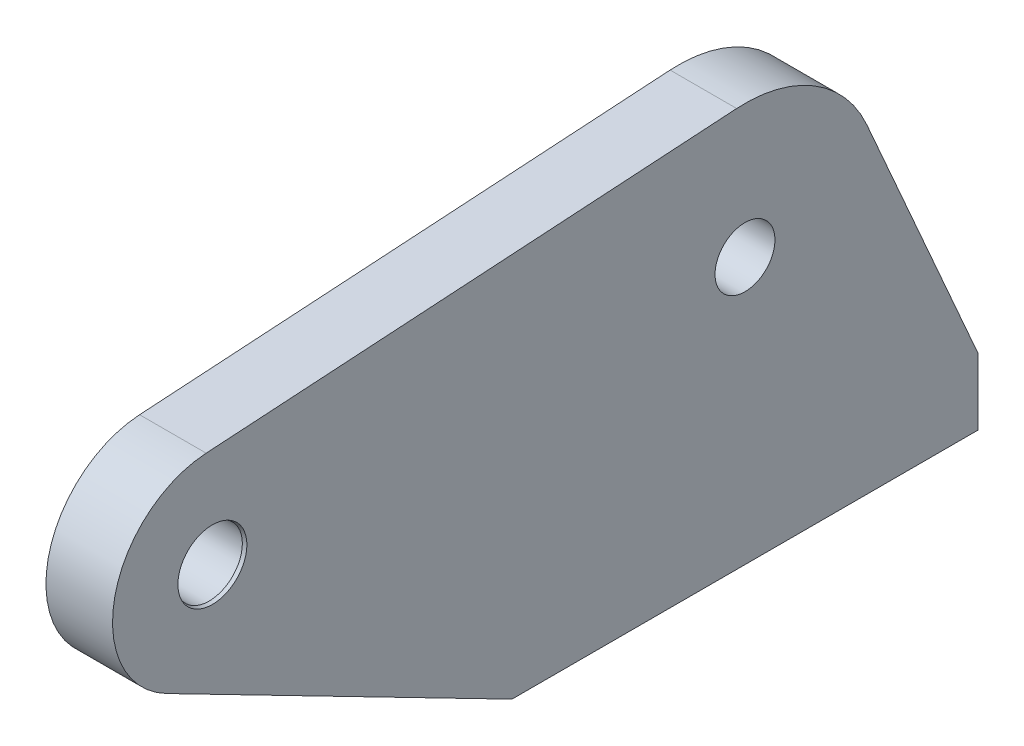
from build123d import *

# Parameters (mm, degrees)
BOSS_EXTRUDE1_DEPTH      = 5
F_9_0_9_DIAMETER_HOLE1_D = 9
M4_TAPPED_HOLE1_D        = 3.3
M4_TAPPED_HOLE1_DEPTH    = 11.5
M4_TAPPED_HOLE1_TIP      = 0.991420021
BOSS_EXTRUDE2_DEPTH      = 10
SKETCH8_R                = 5
CUT_EXTRUDE1_DEPTH       = 10
CHAMFER1_SIZE            = 0.5
CHAMFER1_SIZE2           = 0.181985117


with BuildPart() as part:
    # Sketch1 → Boss-Extrude1 (new, symmetric)
    with BuildSketch(Plane(origin=(0, 0, 0), x_dir=(0, 0, -1), z_dir=(1, 0, 0))):
        with BuildLine():
            Line((-18.315233689, 8.034439304), (-35, -30))
            Line((-35, -30), (-35, -40))
            Line((-35, -40), (35, -40))
            Line((35, -40), (35, -30))
            Line((35, -30), (18.315233689, 8.034439304))
            ThreePointArc((18.315233689, 8.034439304), (0, 20), (-18.315233689, 8.034439304))
        make_face()
    extrude(amount=BOSS_EXTRUDE1_DEPTH, both=True)

    # Ø9.0 (9) Diameter Hole1 (through all)
    with Locations(Plane(origin=(5, 0, 0), x_dir=(0, 0, -1), z_dir=(1, 0, 0))):
        with Locations((0, 0)):
            Hole(F_9_0_9_DIAMETER_HOLE1_D / 2)

    # M4 Tapped Hole1
    with Locations(Plane(origin=(0, -40, 0), x_dir=(-1, 0, 0), z_dir=(0, -1, 0))):
        with Locations((0, -25), (0, -10), (0, 10), (0, 25)):
            Hole(M4_TAPPED_HOLE1_D / 2, depth=M4_TAPPED_HOLE1_DEPTH)
            with Locations((0, 0, -(M4_TAPPED_HOLE1_DEPTH + M4_TAPPED_HOLE1_TIP / 2))):  # 118° drill point
                Cone(0, M4_TAPPED_HOLE1_D / 2, M4_TAPPED_HOLE1_TIP, mode=Mode.SUBTRACT)

    # Sketch7 → Boss-Extrude2 (add)
    with BuildSketch(Plane(origin=(5, 0, 0), x_dir=(0, 0, -1), z_dir=(1, 0, 0))):
        with BuildLine():
            Line((-80.9375, 14.970674459), (-1.25, 19.960899278))
            ThreePointArc((-1.25, 19.960899278), (-11.456862756, 16.393300333), (-18.315233689, 8.034439304))
            Line((-18.315233689, 8.034439304), (-35, -30))
            Line((-35, -30), (-35, -40))
            Line((-35, -40), (-86.858127274, -13.340393184))
            ThreePointArc((-86.858127274, -13.340393184), (-94.682373409, 3.070490366), (-80.9375, 14.970674459))
        make_face()
    extrude(amount=-BOSS_EXTRUDE2_DEPTH)

    # Sketch8 → Cut-Extrude1 (cut)
    with BuildSketch(Plane(origin=(5, 0, 0), x_dir=(0, 0, -1), z_dir=(1, 0, 0))):
        with Locations((-80, 0)):
            Circle(SKETCH8_R)
    extrude(amount=-CUT_EXTRUDE1_DEPTH, mode=Mode.SUBTRACT)

    # Chamfer1
    chamfer1_edges = [part.edges().sort_by_distance(p)[0] for p in [
        (-5, 0, 85),
        (5, 0, 85),
    ]]
    chamfer1_side = [part.faces().sort_by_distance(p)[0] for p in [
        (0, 0, 85),
    ]]
    chamfer(chamfer1_edges, length=CHAMFER1_SIZE, length2=CHAMFER1_SIZE2, reference=chamfer1_side[0])


solid = part.part
